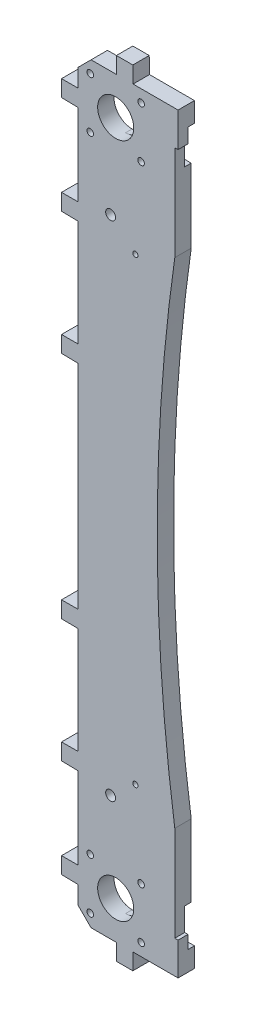
from build123d import *
from build123d.topology import SkipClean

# Parameters (mm, degrees)
SKETCH_2_R          = 2
SKETCH_2_R_2        = 11
SKETCH_2_R_3        = 3
SKETCH_2_R_4        = 1.6
EXTRUDE_1_DEPTH     = 10
CUT_EXTRUDE_2_DEPTH = 4


with BuildPart() as part:
    # Эскиз2 → Бобышка-Вытянуть1 (new body)
    with BuildSketch(Plane.XY):
        with BuildLine():
            Line((-25.5006943, 139.9), (-25.5006943, 109.05))
            Line((-25.5006943, 109.05), (-25.5006943, 75.100000001))
            Line((-25.5006943, 75.100000001), (-35.4993057, 75.066643523))
            Line((-35.4993057, 75.066643523), (-35.4993057, 65.066643523))
            Line((-35.4993057, 65.066643523), (-25.5006943, 64.9))
            Line((-25.5006943, 64.9), (-25.5006943, -64.899999999))
            Line((-25.5006943, -64.899999999), (-35.4993057, -64.933356477))
            Line((-35.4993057, -64.933356477), (-35.4993057, -74.933356477))
            Line((-35.4993057, -74.933356477), (-25.5006943, -75.1))
            Line((-25.5006943, -75.1), (-25.5006943, -105.95))
            Line((-25.5006943, -105.95), (-25.5006943, -139.899999999))
            Line((-25.5006943, -139.899999999), (-35.4993057, -139.933356477))
            Line((-35.4993057, -139.933356477), (-35.4993057, -149.933356477))
            Line((-35.4993057, -149.933356477), (-25.5006943, -150.1))
            Line((-25.5006943, -150.1), (-25.5006943, -173.45))
            Line((-25.5006943, -173.45), (-25.5006943, -199.899999999))
            Line((-25.5006943, -199.899999999), (-35.4993057, -199.933356477))
            Line((-35.4993057, -199.933356477), (-35.4993057, -209.933356477))
            Line((-35.4993057, -209.933356477), (-25.5006943, -210.1))
            Line((-25.5006943, -210.1), (-25.5006943, -221))
            Line((-25.5006943, -221), (-17.5006943, -229))
            Line((-17.5006943, -229), (-2.1006943, -229))
            Line((-2.1006943, -229), (-2.067337824, -238.9986114))
            Line((-2.067337824, -238.9986114), (7.932662176, -238.9986114))
            Line((7.932662176, -238.9986114), (8.099305701, -229))
            Line((8.099305701, -229), (35.4993057, -229))
            Line((35.4993057, -229), (35.4993057, -209))
            Line((35.4993057, -209), (33.4993057, -209))
            Line((33.4993057, -209), (33.4993057, -151))
            ThreePointArc((33.4993057, -151), (22.78974844, -0.441666666), (33.4993057, 150.116666668))
            Line((33.4993057, 150.116666668), (33.4993057, 208.116666668))
            Line((33.4993057, 208.116666668), (35.4993057, 208.116666668))
            Line((35.4993057, 208.116666668), (35.4993057, 229))
            Line((35.4993057, 229), (8.099305701, 229))
            Line((8.099305701, 229), (7.932662176, 238.9986114))
            Line((7.932662176, 238.9986114), (-2.067337824, 238.9986114))
            Line((-2.067337824, 238.9986114), (-2.1006943, 229))
            Line((-2.1006943, 229), (-17.5006943, 229))
            Line((-17.5006943, 229), (-25.5006943, 221))
            Line((-25.5006943, 221), (-25.5006943, 210.100000001))
            Line((-25.5006943, 210.100000001), (-35.4993057, 210.066643523))
            Line((-35.4993057, 210.066643523), (-35.4993057, 200.066643523))
            Line((-35.4993057, 200.066643523), (-25.5006943, 199.9))
            Line((-25.5006943, 199.9), (-25.5006943, 176.55))
            Line((-25.5006943, 176.55), (-25.5006943, 150.100000001))
            Line((-25.5006943, 150.100000001), (-35.4993057, 150.066643523))
            Line((-35.4993057, 150.066643523), (-35.4993057, 140.066643523))
            Line((-35.4993057, 140.066643523), (-25.5006943, 139.9))
        make_face()
        with Locations((-18.0006943, -190.5)):
            Circle(SKETCH_2_R, mode=Mode.SUBTRACT)
        with Locations((-18.0006943, -221.5)):
            Circle(SKETCH_2_R, mode=Mode.SUBTRACT)
        with Locations((-18.0006943, 190.5)):
            Circle(SKETCH_2_R, mode=Mode.SUBTRACT)
        with Locations((12.9993057, 221.5)):
            Circle(SKETCH_2_R, mode=Mode.SUBTRACT)
        with Locations((-2.5006943, -206)):
            Circle(SKETCH_2_R_2, mode=Mode.SUBTRACT)
        with Locations((-2.5006943, 206)):
            Circle(SKETCH_2_R_2, mode=Mode.SUBTRACT)
        with Locations((-18.0006943, 221.5)):
            Circle(SKETCH_2_R, mode=Mode.SUBTRACT)
        with Locations((12.9993057, -221.5)):
            Circle(SKETCH_2_R, mode=Mode.SUBTRACT)
        with Locations((12.9993057, -190.5)):
            Circle(SKETCH_2_R, mode=Mode.SUBTRACT)
        with Locations((12.9993057, 190.5)):
            Circle(SKETCH_2_R, mode=Mode.SUBTRACT)
        with Locations((-5.6006943, -153.2)):
            Circle(SKETCH_2_R_3, mode=Mode.SUBTRACT)
        with Locations((-5.6006943, 153.2)):
            Circle(SKETCH_2_R_3, mode=Mode.SUBTRACT)
        with Locations((9.4993057, -139.899999999)):
            Circle(SKETCH_2_R_4, mode=Mode.SUBTRACT)
        with Locations((9.4993057, 139.9)):
            Circle(SKETCH_2_R_4, mode=Mode.SUBTRACT)
    extrude(amount=EXTRUDE_1_DEPTH)

    # Эскиз4 → Вырез-Вытянуть2 (cut)
    with SkipClean():  # the faces are left unmerged after this step: merging them gives an invalid solid
        with BuildSketch(Plane.XY):
            with BuildLine():
                Line((-2.5006943, 217), (35.4993057, 217))
                Line((35.4993057, 217), (35.4993057, 195))
                Line((35.4993057, 195), (-2.5006943, 195))
                ThreePointArc((-2.5006943, 195), (-13.5006943, 206), (-2.5006943, 217))
            make_face()
            with BuildLine():
                Line((-2.5006943, -217), (35.4993057, -217))
                Line((35.4993057, -217), (35.4993057, -195))
                Line((35.4993057, -195), (-2.5006943, -195))
                ThreePointArc((-2.5006943, -195), (-13.5006943, -206), (-2.5006943, -217))
            make_face()
        extrude(amount=CUT_EXTRUDE_2_DEPTH, mode=Mode.SUBTRACT)


solid = part.part
